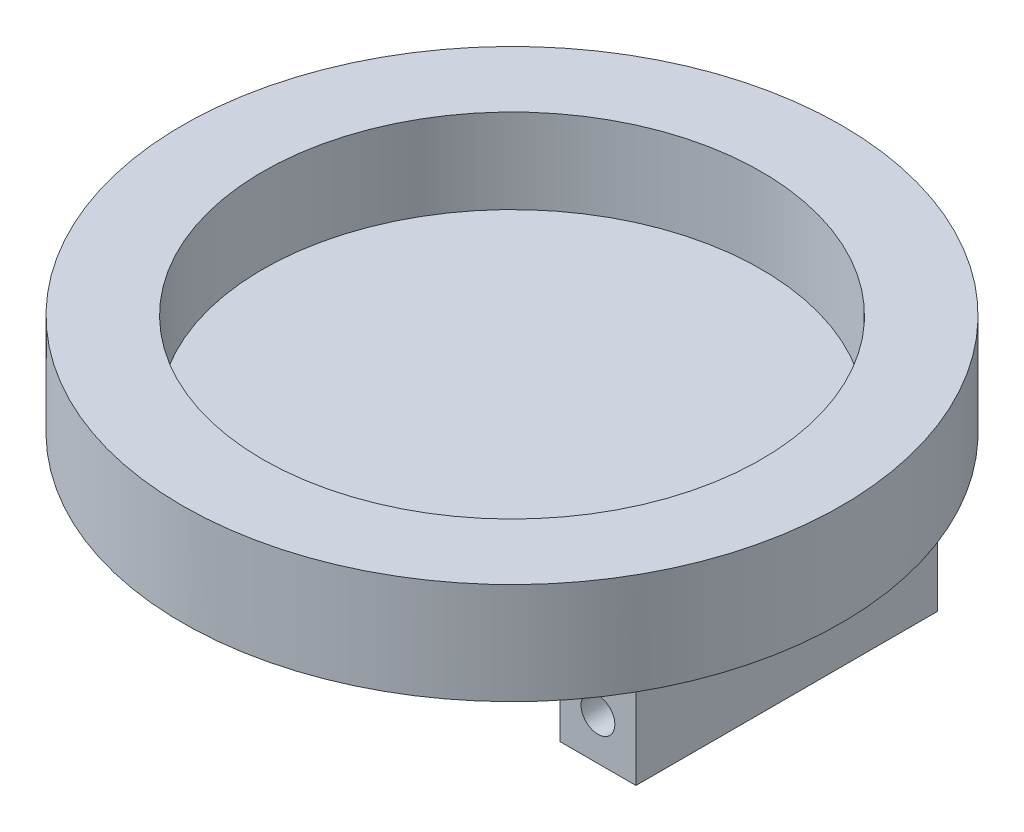
from build123d import *

# Parameters (mm, degrees)
SKETCH1_R           = 247.65
SKETCH1_R_2         = 187.325
BOSS_EXTRUDE1_DEPTH = 63.5
BOSS_EXTRUDE2_START = 12.7
SKETCH2_R           = 247.65
BOSS_EXTRUDE2_DEPTH = 12.7
BOSS_EXTRUDE3_START = 82.55
BOSS_EXTRUDE3_DEPTH = 69.85
CUT_EXTRUDE1_REACH  = 447.403
SKETCH4_R           = 12.7


with BuildPart() as part:
    # Sketch1 → Boss-Extrude1 (new body)
    with BuildSketch(Plane(origin=(0, 0, 0), x_dir=(1, 0, 0), z_dir=(0, 1, 0))):
        with Locations(Location((0, 0, 0), (0, 0, 270))):
            Circle(SKETCH1_R)
        with Locations(Location((0, 0, 0), (0, 0, 270))):
            Circle(SKETCH1_R_2, mode=Mode.SUBTRACT)
    extrude(amount=BOSS_EXTRUDE1_DEPTH)

    # Sketch2 → Boss-Extrude2 (add)
    # profile 1 of 6: a face of its own
    with BuildSketch(Plane.XZ.offset(BOSS_EXTRUDE2_START)):
        with Locations(Location((0, 0, 0), (0, 0, 270))):
            Circle(SKETCH2_R)
        with BuildLine():
            Line((-206.375, -113.236721076), (-206.375, 113.236721076))
            Line((-206.375, 113.236721076), (-149.225, 113.236721076))
            ThreePointArc((-149.225, 113.236721076), (0, 187.325), (149.225, 113.236721076))
            Line((149.225, 113.236721076), (206.375, 113.236721076))
            Line((206.375, 113.236721076), (206.375, -113.236721076))
            Line((206.375, -113.236721076), (149.225, -113.236721076))
            ThreePointArc((149.225, -113.236721076), (0, -187.325), (-149.225, -113.236721076))
            Line((-149.225, -113.236721076), (-206.375, -113.236721076))
        make_face(mode=Mode.SUBTRACT)
    # profile 2 of 6: a face of its own
    with BuildSketch(Plane.XZ.offset(BOSS_EXTRUDE2_START)):
        with BuildLine():
            Line((206.375, 113.236721076), (149.225, 113.236721076))
            ThreePointArc((149.225, 113.236721076), (177.544682756, 59.737268518), (187.325, 0))
            ThreePointArc((187.325, 0), (177.544682756, -59.737268518), (149.225, -113.236721076))
            Line((149.225, -113.236721076), (206.375, -113.236721076))
            Line((206.375, -113.236721076), (206.375, 113.236721076))
        make_face()
    # profile 3 of 6: a face of its own
    with BuildSketch(Plane.XZ.offset(BOSS_EXTRUDE2_START)):
        with BuildLine():
            ThreePointArc((187.325, 0), (177.544682756, 59.737268518), (149.225, 113.236721076))
            Line((149.225, 113.236721076), (149.225, -113.236721076))
            ThreePointArc((149.225, -113.236721076), (177.544682756, -59.737268518), (187.325, 0))
        make_face()
    # profile 4 of 6: a face of its own
    with BuildSketch(Plane.XZ.offset(BOSS_EXTRUDE2_START)):
        with BuildLine():
            Line((-149.225, -113.236721076), (-149.225, 113.236721076))
            ThreePointArc((-149.225, 113.236721076), (-187.325, 0), (-149.225, -113.236721076))
        make_face()
    # profile 5 of 6: a face of its own
    with BuildSketch(Plane.XZ.offset(BOSS_EXTRUDE2_START)):
        with BuildLine():
            ThreePointArc((149.225, 113.236721076), (0, 187.325), (-149.225, 113.236721076))
            Line((-149.225, 113.236721076), (-149.225, -113.236721076))
            ThreePointArc((-149.225, -113.236721076), (0, -187.325), (149.225, -113.236721076))
            Line((149.225, -113.236721076), (149.225, 113.236721076))
        make_face()
    # profile 6 of 6: a face of its own
    with BuildSketch(Plane.XZ.offset(BOSS_EXTRUDE2_START)):
        with BuildLine():
            Line((-149.225, 113.236721076), (-206.375, 113.236721076))
            Line((-206.375, 113.236721076), (-206.375, -113.236721076))
            Line((-206.375, -113.236721076), (-149.225, -113.236721076))
            ThreePointArc((-149.225, -113.236721076), (-187.325, 0), (-149.225, 113.236721076))
        make_face()
    extrude(amount=-BOSS_EXTRUDE2_DEPTH)

    # Sketch2<3> → Boss-Extrude3 (add)
    with BuildSketch(Plane.XZ.offset(BOSS_EXTRUDE3_START)):
        with BuildLine():
            Line((-149.225, -113.236721076), (-149.225, 113.236721076))
            ThreePointArc((-149.225, 113.236721076), (-187.325, 0), (-149.225, -113.236721076))
        make_face()
        with BuildLine():
            Line((-149.225, 113.236721076), (-206.375, 113.236721076))
            Line((-206.375, 113.236721076), (-206.375, -113.236721076))
            Line((-206.375, -113.236721076), (-149.225, -113.236721076))
            ThreePointArc((-149.225, -113.236721076), (-187.325, 0), (-149.225, 113.236721076))
        make_face()
        with BuildLine():
            Line((206.375, 113.236721076), (149.225, 113.236721076))
            ThreePointArc((149.225, 113.236721076), (177.544682756, 59.737268518), (187.325, 0))
            ThreePointArc((187.325, 0), (177.544682756, -59.737268518), (149.225, -113.236721076))
            Line((149.225, -113.236721076), (206.375, -113.236721076))
            Line((206.375, -113.236721076), (206.375, 113.236721076))
        make_face()
        with BuildLine():
            ThreePointArc((187.325, 0), (177.544682756, 59.737268518), (149.225, 113.236721076))
            Line((149.225, 113.236721076), (149.225, -113.236721076))
            ThreePointArc((149.225, -113.236721076), (177.544682756, -59.737268518), (187.325, 0))
        make_face()
    extrude(amount=-BOSS_EXTRUDE3_DEPTH)

    # Sketch4 → Cut-Extrude1 (cut, up to next)
    with BuildSketch(Plane.XY.offset(113.236721076), mode=Mode.PRIVATE) as cut_extrude1_sk1:
        with Locations((177.8, -50.8)):
            Circle(SKETCH4_R)
    cut_extrude1_tool1 = extrude(cut_extrude1_sk1.sketch, amount=-CUT_EXTRUDE1_REACH, mode=Mode.PRIVATE) & part.part
    # Sketch4 → Cut-Extrude1 (cut, up to next)
    with BuildSketch(Plane.XY.offset(113.236721076), mode=Mode.PRIVATE) as cut_extrude1_sk2:
        with Locations((-177.8, -50.8)):
            Circle(SKETCH4_R)
    cut_extrude1_tool2 = extrude(cut_extrude1_sk2.sketch, amount=-CUT_EXTRUDE1_REACH, mode=Mode.PRIVATE) & part.part
    add(cut_extrude1_tool1.solids().sort_by_distance((177.8, -50.8, 113.236721))[0], mode=Mode.SUBTRACT)
    add(cut_extrude1_tool2.solids().sort_by_distance((-177.8, -50.8, 113.236721))[0], mode=Mode.SUBTRACT)


solid = part.part
